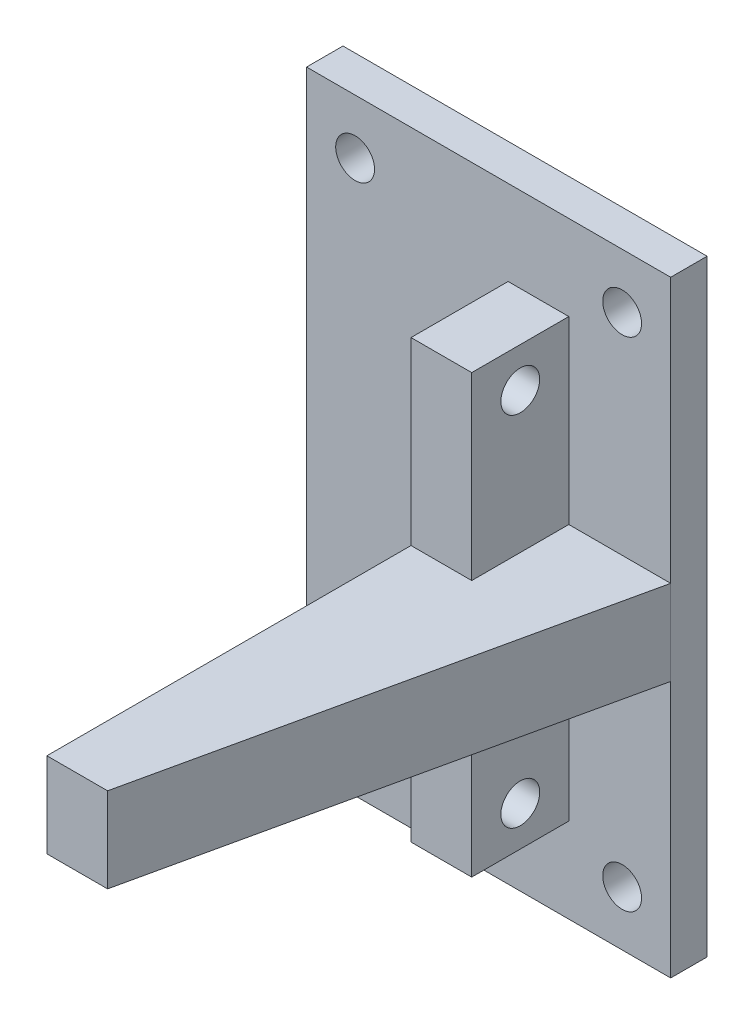
from build123d import *

# Parameters (mm, degrees)
SKETCH_1_W          = 30
SKETCH_1_H          = 50
SKETCH_1_R          = 1.6
EXTRUDE_1_DEPTH     = 3
SKETCH_2_W          = 5
SKETCH_2_H          = 36
EXTRUDE_2_DEPTH     = 8
SKETCH_5_R          = 1.6
CUT_EXTRUDE_1_DEPTH = 10
SKETCH_6_W          = 5
SKETCH_6_H          = 7
EXTRUDE_3_DEPTH     = 30
RIB_1_REACH         = 65.828
SKETCH_7_WALL_W     = 168.57168005
SKETCH_7_WALL_H     = 7


with BuildPart() as part:
    # 草图1 → 凸台-拉伸1 (new body)
    with BuildSketch(Plane.XY):
        with Locations((-25, -15)):
            Rectangle(SKETCH_1_W, SKETCH_1_H)
        with Locations((-14, 5.5)):
            Circle(SKETCH_1_R, mode=Mode.SUBTRACT)
        with Locations((-36, -35.5)):
            Circle(SKETCH_1_R, mode=Mode.SUBTRACT)
        with Locations((-14, -35.5)):
            Circle(SKETCH_1_R, mode=Mode.SUBTRACT)
        with Locations((-36, 5.5)):
            Circle(SKETCH_1_R, mode=Mode.SUBTRACT)
    extrude(amount=EXTRUDE_1_DEPTH)

    # 草图2 → 凸台-拉伸2 (add)
    with BuildSketch(Plane.XY.offset(3)):
        with Locations((-20.894219559, -15)):
            Rectangle(SKETCH_2_W, SKETCH_2_H)
    extrude(amount=EXTRUDE_2_DEPTH)

    # 草图5 → 切除-拉伸1 (cut)
    with BuildSketch(Plane(origin=(-18.394219559, 0, 0), x_dir=(0, 0, -1), z_dir=(1, 0, 0))):
        with Locations(Location((-7, -0.268, 0), (0, 0, 90))):
            Circle(SKETCH_5_R)
        with Locations(Location((-7, -29.732, 0), (0, 0, 90))):
            Circle(SKETCH_5_R)
    extrude(amount=-CUT_EXTRUDE_1_DEPTH, mode=Mode.SUBTRACT)

    # 草图6 → 凸台-拉伸3 (add)
    with BuildSketch(Plane.XY.offset(11)):
        with Locations((-20.894219559, -15.339980262)):
            Rectangle(SKETCH_6_W, SKETCH_6_H)
    extrude(amount=EXTRUDE_3_DEPTH)

    # 草图7 wall → 筋1 (add, up to next)
    with BuildSketch(Plane(origin=(-14.197109779, -11.839980262, 22), x_dir=(0.215700425519, 0, -0.97645958771), z_dir=(-0.97645958771, 0, -0.215700425519)), mode=Mode.PRIVATE) as rib_1_sk1:
        with Locations((0, 3.5)):
            Rectangle(SKETCH_7_WALL_W, SKETCH_7_WALL_H)
    rib_1_tool1 = extrude(rib_1_sk1.sketch, amount=RIB_1_REACH, mode=Mode.PRIVATE) - part.part
    add(rib_1_tool1.solids().sort_by_distance((-14.197109779, -11.839980262, 22))[0])


solid = part.part
